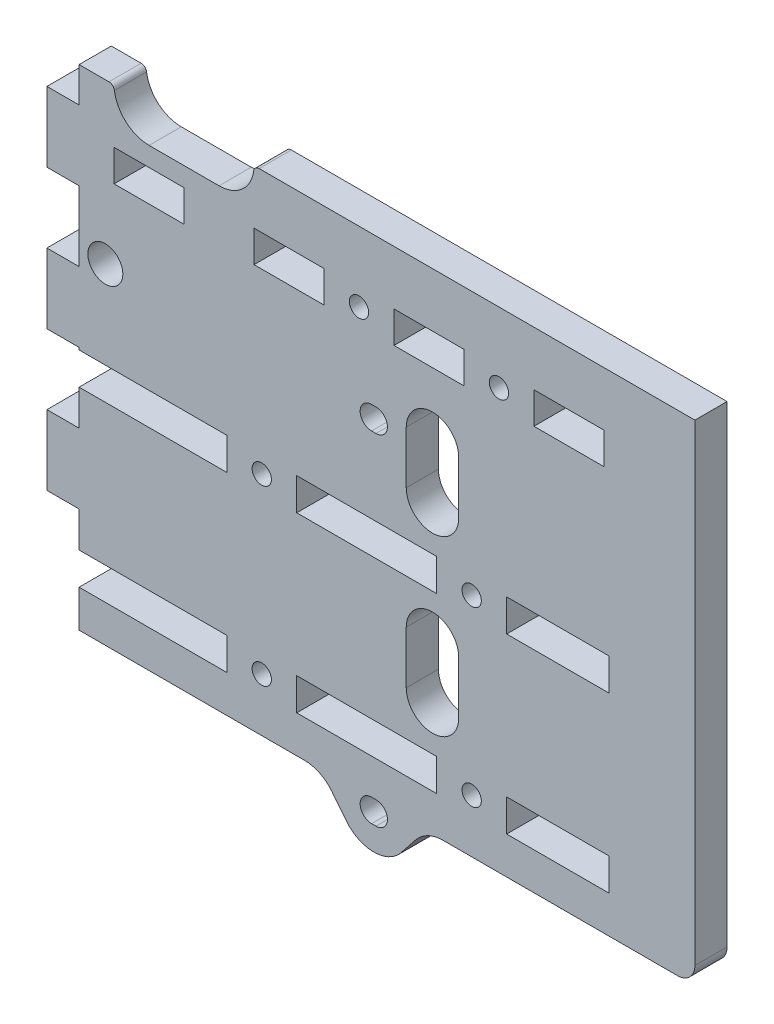
from build123d import *

# Parameters (mm, degrees)
SKETCH1_R           = 1.7526
SKETCH1_W           = 12.7
SKETCH1_H           = 5.742
BOSS_EXTRUDE1_DEPTH = 5.842
SKETCH2_R           = 3.175
CUT_EXTRUDE1_DEPTH  = 82.290714919
FILLET1_R           = 6.35
CUT_EXTRUDE2_DEPTH  = 82.290714919
FILLET2_R           = 1
FILLET3_R           = 3.175
CUT_EXTRUDE3_DEPTH  = 82.290714919


with BuildPart() as part:
    # Sketch1 → Boss-Extrude1 (new body)
    with BuildSketch(Plane.XY):
        with BuildLine():
            Line((-61.722, 0), (-61.722, 12.7))
            Line((-61.722, 12.7), (-55.88, 12.7))
            Line((-55.88, 12.7), (-55.88, 25.4))
            Line((-55.88, 25.4), (-61.722, 25.4))
            Line((-61.722, 25.4), (-61.722, 38.1))
            Line((-61.722, 38.1), (-55.88, 38.1))
            Line((-55.88, 38.1), (-55.88, 44.45))
            Line((-55.88, 44.45), (55.88, 44.45))
            Line((55.88, 44.45), (55.88, -44.45))
            Line((55.88, -44.45), (7.127875, -44.45))
            Line((7.127875, -44.45), (2.573780292, -50.179278348))
            ThreePointArc((2.573780292, -50.179278348), (-2.397125, -52.578), (-7.368030292, -50.179278348))
            Line((-7.368030292, -50.179278348), (-11.922125, -44.45))
            Line((-11.922125, -44.45), (-55.88, -44.45))
            Line((-55.88, -44.45), (-55.88, -37.692))
            Line((-55.88, -37.692), (-29.083, -37.692))
            Line((-29.083, -37.692), (-29.083, -31.85))
            Line((-29.083, -31.85), (-55.88, -31.85))
            Line((-55.88, -31.85), (-55.88, -25.4))
            Line((-55.88, -25.4), (-61.722, -25.4))
            Line((-61.722, -25.4), (-61.722, -12.7))
            Line((-61.722, -12.7), (-55.88, -12.7))
            Line((-55.88, -12.7), (-55.88, -6.25))
            Line((-55.88, -6.25), (-29.083, -6.25))
            Line((-29.083, -6.25), (-29.083, -0.408))
            Line((-29.083, -0.408), (-55.88, -0.408))
            Line((-55.88, -0.408), (-55.88, 0))
            Line((-55.88, 0), (-61.722, 0))
        make_face()
        with Locations((-22.733, -3.329)):
            Circle(SKETCH1_R, mode=Mode.SUBTRACT)
        with Locations((15.367, -3.329)):
            Circle(SKETCH1_R, mode=Mode.SUBTRACT)
        with Locations(Location((15.367, -34.771, 0), (0, 0, 180))):
            Circle(SKETCH1_R, mode=Mode.SUBTRACT)
        with Locations(Location((-22.733, -34.771, 0), (0, 0, 180))):
            Circle(SKETCH1_R, mode=Mode.SUBTRACT)
        with Locations((-5.08, 31.75)):
            Circle(SKETCH1_R, mode=Mode.SUBTRACT)
        with Locations((20.32, 31.75)):
            Circle(SKETCH1_R, mode=Mode.SUBTRACT)
        Polygon((9.017, -0.408), (-10.541, -0.408), (-16.383, -0.408), (-16.383, -6.25), (-10.541, -6.25), (9.017, -6.25), align=None, mode=Mode.SUBTRACT)
        Polygon((27.559, -0.408), (21.717, -0.408), (21.717, -6.25), (27.559, -6.25), (40.259, -6.25), (40.259, -0.408), align=None, mode=Mode.SUBTRACT)
        Polygon((21.717, -37.692), (21.717, -31.85), (27.559, -31.85), (40.259, -31.85), (40.259, -37.692), (27.559, -37.692), align=None, mode=Mode.SUBTRACT)
        Polygon((-16.383, -37.692), (-16.383, -31.85), (-10.541, -31.85), (9.017, -31.85), (9.017, -37.692), (-10.541, -37.692), align=None, mode=Mode.SUBTRACT)
        with BuildLine():
            Line((-2.794, -44.1452), (-2.00025, -44.1452))
            ThreePointArc((-2.00025, -44.1452), (0.08255, -46.228), (-2.00025, -48.3108))
            Line((-2.00025, -48.3108), (-2.794, -48.3108))
            ThreePointArc((-2.794, -48.3108), (-4.8768, -46.228), (-2.794, -44.1452))
        make_face(mode=Mode.SUBTRACT)
        with BuildLine():
            Line((-2.794, 17.5768), (-2.00025, 17.5768))
            ThreePointArc((-2.00025, 17.5768), (0.08255, 15.494), (-2.00025, 13.4112))
            Line((-2.00025, 13.4112), (-2.794, 13.4112))
            ThreePointArc((-2.794, 13.4112), (-4.8768, 15.494), (-2.794, 17.5768))
        make_face(mode=Mode.SUBTRACT)
        with Locations((-17.78, 31.75)):
            Rectangle(SKETCH1_W, SKETCH1_H, mode=Mode.SUBTRACT)
        with Locations((-43.18, 31.75)):
            Rectangle(SKETCH1_W, SKETCH1_H, mode=Mode.SUBTRACT)
        with Locations((7.62, 31.75)):
            Rectangle(SKETCH1_W, SKETCH1_H, mode=Mode.SUBTRACT)
        with Locations((33.02, 31.75)):
            Rectangle(SKETCH1_W, SKETCH1_H, mode=Mode.SUBTRACT)
    extrude(amount=BOSS_EXTRUDE1_DEPTH)

    # Sketch2 → Cut-Extrude1 (cut, through all)
    with BuildSketch(Plane.XY.offset(5.842)):
        with Locations((-51.1175, 15.494)):
            Circle(SKETCH2_R)
    extrude(amount=-CUT_EXTRUDE1_DEPTH, mode=Mode.SUBTRACT)

    # Fillet1
    fillet1_edges = [part.edges().sort_by_distance(p)[0] for p in [
        (7.127875, -44.45, 2.921),
        (-11.922125, -44.45, 2.921),
    ]]
    fillet(fillet1_edges, radius=FILLET1_R)

    # Sketch4 → Cut-Extrude2 (cut, through all)
    with BuildSketch(Plane.XY.offset(5.842)):
        with BuildLine():
            Line((-43.18, 50.8), (-30.48, 50.8))
            ThreePointArc((-30.48, 50.8), (-24.13, 44.45), (-30.48, 38.1))
            Line((-30.48, 38.1), (-43.18, 38.1))
            ThreePointArc((-43.18, 38.1), (-49.53, 44.45), (-43.18, 50.8))
        make_face()
    extrude(amount=-CUT_EXTRUDE2_DEPTH, mode=Mode.SUBTRACT)

    # Fillet2
    fillet2_edges = [part.edges().sort_by_distance(p)[0] for p in [
        (-24.13, 44.45, 2.921),
        (-49.53, 44.45, 2.921),
    ]]
    fillet(fillet2_edges, radius=FILLET2_R)

    # Fillet3
    fillet3_edges = [part.edges().sort_by_distance(p)[0] for p in [
        (55.88, -44.45, 2.921),
    ]]
    fillet(fillet3_edges, radius=FILLET3_R)

    # Sketch5 → Cut-Extrude3 (cut, through all)
    with BuildSketch(Plane.XY.offset(5.842)):
        with BuildLine():
            Line((3.4925, -23.8125), (3.4925, -14.2875))
            ThreePointArc((3.4925, -14.2875), (8.255, -9.525), (13.0175, -14.2875))
            Line((13.0175, -14.2875), (13.0175, -23.8125))
            ThreePointArc((13.0175, -23.8125), (8.255, -28.575), (3.4925, -23.8125))
        make_face()
        with BuildLine():
            Line((3.4925, 17.1545), (3.4925, 7.6295))
            ThreePointArc((3.4925, 7.6295), (8.255, 2.867), (13.0175, 7.6295))
            Line((13.0175, 7.6295), (13.0175, 17.1545))
            ThreePointArc((13.0175, 17.1545), (8.255, 21.917), (3.4925, 17.1545))
        make_face()
    extrude(amount=-CUT_EXTRUDE3_DEPTH, mode=Mode.SUBTRACT)


solid = part.part
